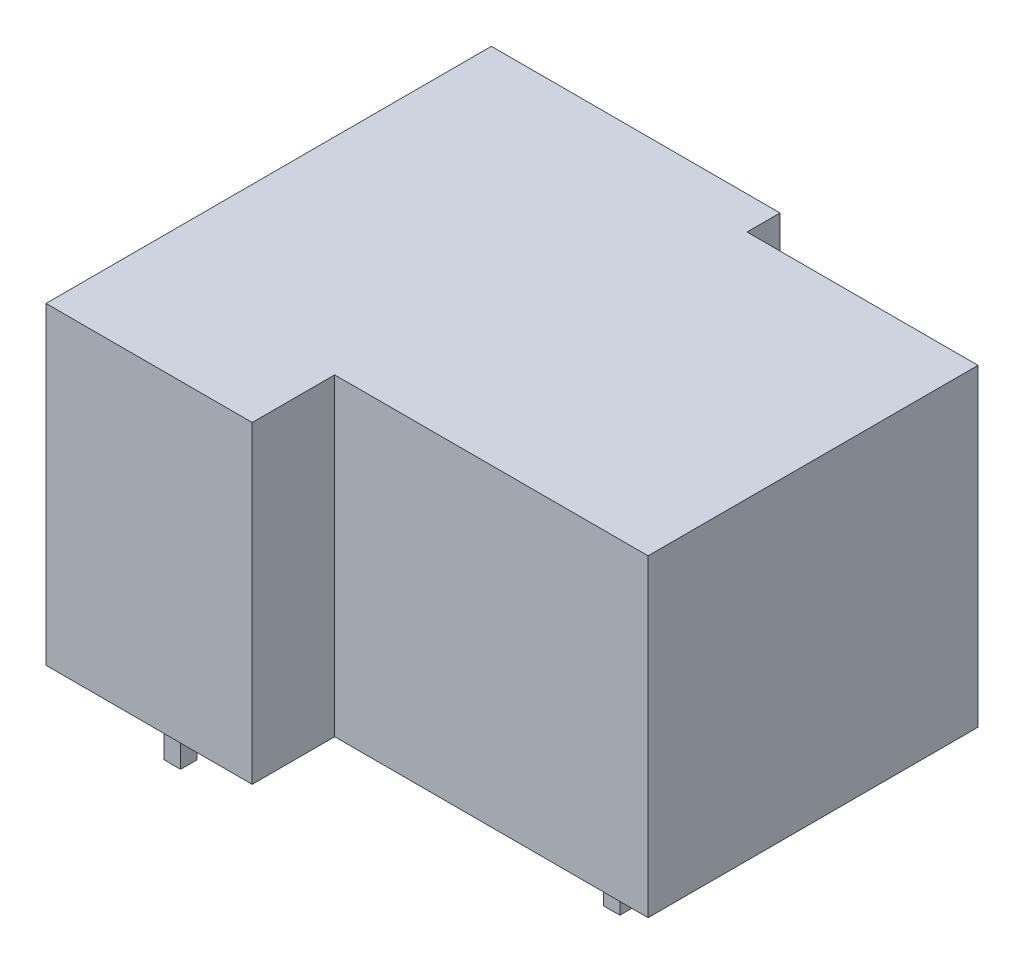
from build123d import *

# Parameters (mm, degrees)
EXTRUDE_1_DEPTH = 19
SKETCH_2_W      = 1
SKETCH_2_H      = 1
EXTRUDE_2_DEPTH = 3.5


with BuildPart() as part:
    # 草图1 → 拉伸1 (new body)
    with BuildSketch(Plane(origin=(0, 0, 0), x_dir=(1, 0, 0), z_dir=(0, 1, 0))):
        Polygon((5, 10), (19, 10), (19, -10), (0, -10), (0, -15), (-12.5, -15), (-12.5, 12), (5, 12), align=None)
    extrude(amount=EXTRUDE_1_DEPTH)

    # 草图2 → 拉伸2 (add)
    with BuildSketch(Plane.XZ):
        with Locations((13.831603364, -8.022376545)):
            Rectangle(SKETCH_2_W, SKETCH_2_H)
        with Locations((14.016943938, 6.726433021)):
            Rectangle(SKETCH_2_W, SKETCH_2_H)
        with Locations((-6.96, 12.382327248)):
            Rectangle(SKETCH_2_W, SKETCH_2_H)
        with Locations((-1.289220796, -9.277739781)):
            Rectangle(SKETCH_2_W, SKETCH_2_H)
        with Locations((-9.959378068, -9.338614045)):
            Rectangle(SKETCH_2_W, SKETCH_2_H)
    extrude(amount=EXTRUDE_2_DEPTH)


solid = part.part
